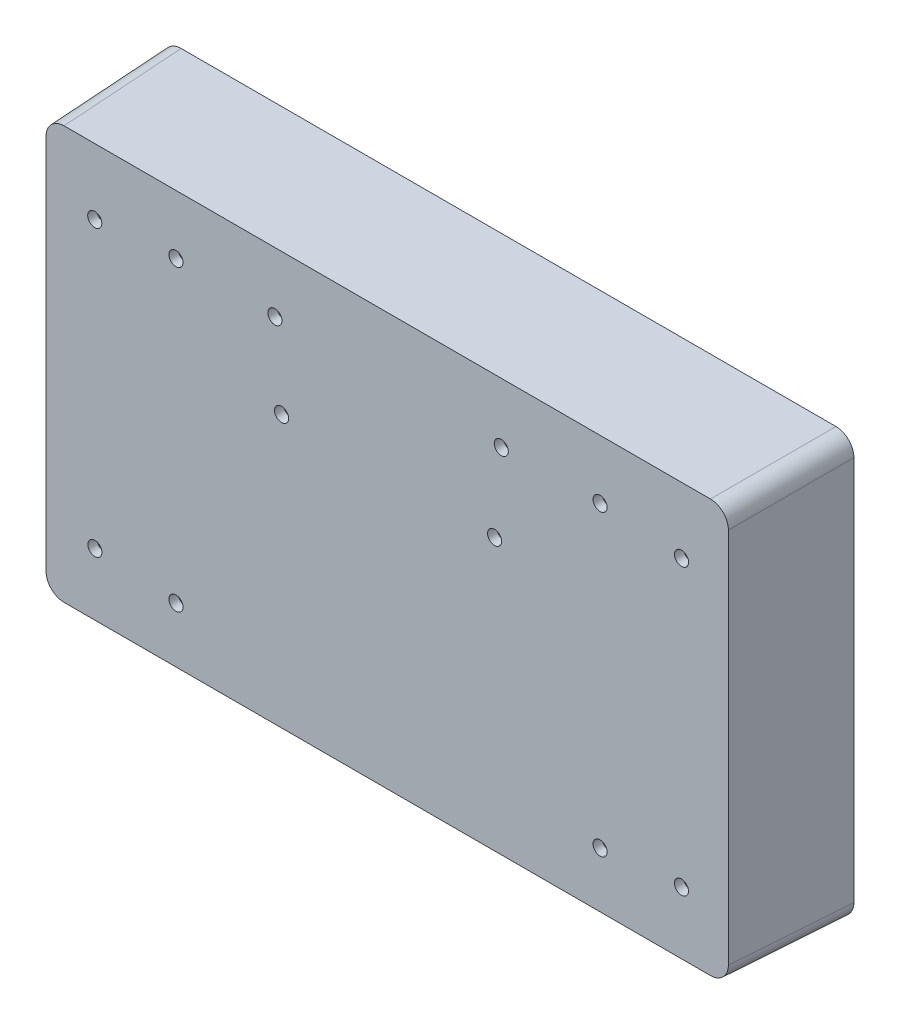
from build123d import *

# Parameters (mm, degrees)
SKETCH_1_W      = 148
SKETCH_1_H      = 88
SKETCH_1_R      = 1.5
EXTRUDE_1_DEPTH = 25
EXTRUDE_1_DRAFT = 2
FILLET_1_R      = 2
SHELL_1_T       = 2


with BuildPart() as part:
    # Эскиз1 → Бобышка-Вытянуть1 (with draft: the straight prism first)
    with BuildSketch(Plane.XY):
        with Locations((-40.018678, 18.487832)):
            Rectangle(SKETCH_1_W, SKETCH_1_H)
        with Locations((7.364962, 51.289097)):
            Circle(SKETCH_1_R, mode=Mode.SUBTRACT)
        with Locations((25.491262, 49.776217)):
            Circle(SKETCH_1_R, mode=Mode.SUBTRACT)
        with Locations((25.471663, -13.623467)):
            Circle(SKETCH_1_R, mode=Mode.SUBTRACT)
        with Locations((7.364962, -15.128048)):
            Circle(SKETCH_1_R, mode=Mode.SUBTRACT)
        with Locations((-14.633582, 51.078679)):
            Circle(SKETCH_1_R, mode=Mode.SUBTRACT)
        with Locations((-16.116192, 32.998149)):
            Circle(SKETCH_1_R, mode=Mode.SUBTRACT)
        with Locations((-65.018894, 51.078679)):
            Circle(SKETCH_1_R, mode=Mode.SUBTRACT)
        with Locations((-63.53497, 32.998149)):
            Circle(SKETCH_1_R, mode=Mode.SUBTRACT)
        with Locations((-87.0372, 51.289097)):
            Circle(SKETCH_1_R, mode=Mode.SUBTRACT)
        with Locations((-105.122155, 49.776217)):
            Circle(SKETCH_1_R, mode=Mode.SUBTRACT)
        with Locations((-87.0372, -15.128048)):
            Circle(SKETCH_1_R, mode=Mode.SUBTRACT)
        with Locations((-105.094004, -13.623467)):
            Circle(SKETCH_1_R, mode=Mode.SUBTRACT)
    extrude(amount=-EXTRUDE_1_DEPTH)
    # Бобышка-Вытянуть1: the draft: its side faces are tilted about the plane it starts from
    extrude_1_sides = [part.faces().sort_by_distance(p)[0] for p in [
        (-40.018678, 62.487832, -12.5),
        (-114.018678, 18.487832, -12.5),
        (-40.018678, -25.512168, -12.5),
        (33.981322, 18.487832, -12.5),
        (5.864962, 51.289097, -12.5),
        (23.991262, 49.776217, -12.5),
        (23.971663, -13.623467, -12.5),
        (5.864962, -15.128048, -12.5),
        (-16.133582, 51.078679, -12.5),
        (-17.616192, 32.998149, -12.5),
        (-66.518894, 51.078679, -12.5),
        (-65.03497, 32.998149, -12.5),
        (-88.5372, 51.289097, -12.5),
        (-106.622155, 49.776217, -12.5),
        (-88.5372, -15.128048, -12.5),
        (-106.594004, -13.623467, -12.5),
    ]]
    draft(extrude_1_sides, Plane.XY, EXTRUDE_1_DRAFT)

    # Скругление1
    fillet_1_edges = [part.edges().sort_by_distance(p)[0] for p in [
        (34.417831, -25.948678, -12.5),
        (-114.455188, -25.948678, -12.5),
        (-114.455188, 62.924342, -12.5),
        (34.417831, 62.924342, -12.5),
    ]]
    fillet(fillet_1_edges, radius=FILLET_1_R)

    # Оболочка1
    shell_1_openings = [part.faces().sort_by_distance(p)[0] for p in [
        (-40.018892, 18.479465, -25),
        (6.301471, 51.289097, -12.5),
        (24.427772, 49.776217, -12.5),
        (24.408173, -13.623467, -12.5),
        (6.301471, -15.128048, -12.5),
        (-15.697073, 51.078679, -12.5),
        (-17.179682, 32.998149, -12.5),
        (-66.082384, 51.078679, -12.5),
        (-64.59846, 32.998149, -12.5),
        (-88.10069, 51.289097, -12.5),
        (-106.185646, 49.776217, -12.5),
        (-88.10069, -15.128048, -12.5),
        (-106.157495, -13.623467, -12.5),
    ]]
    offset(amount=SHELL_1_T, openings=shell_1_openings, kind=Kind.INTERSECTION)


solid = part.part
